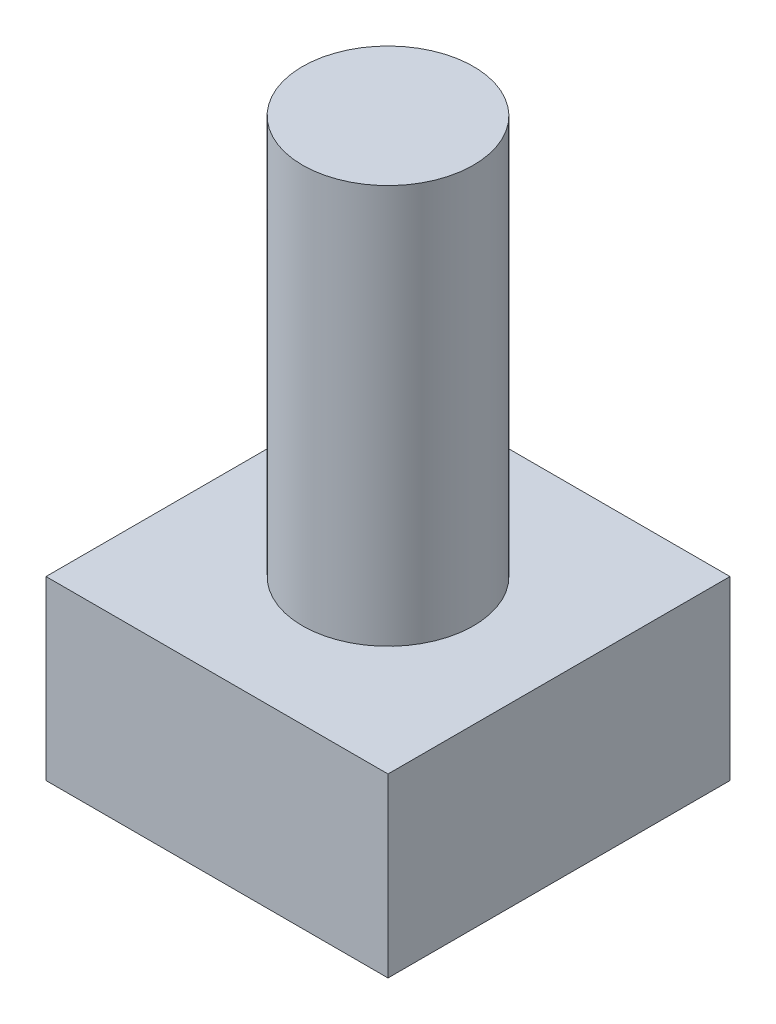
from build123d import *

# Parameters (mm, degrees)
SKETCH_1_W      = 6
SKETCH_1_H      = 6
EXTRUDE_1_DEPTH = 3.1
SKETCH_2_R      = 1.5
EXTRUDE_2_DEPTH = 7


with BuildPart() as part:
    # 草图1 → 拉伸1 (new body)
    with BuildSketch(Plane(origin=(0, 0, 0), x_dir=(1, 0, 0), z_dir=(0, 1, 0))):
        Rectangle(SKETCH_1_W, SKETCH_1_H)
    extrude(amount=EXTRUDE_1_DEPTH)

    # 草图2 → 拉伸2 (add)
    with BuildSketch(Plane(origin=(0, 3.1, 0), x_dir=(-1, 0, 0), z_dir=(0, 1, 0))):
        with Locations(Location((0, 0, 0), (0, 0, 90))):
            Circle(SKETCH_2_R)
    extrude(amount=EXTRUDE_2_DEPTH)


solid = part.part
